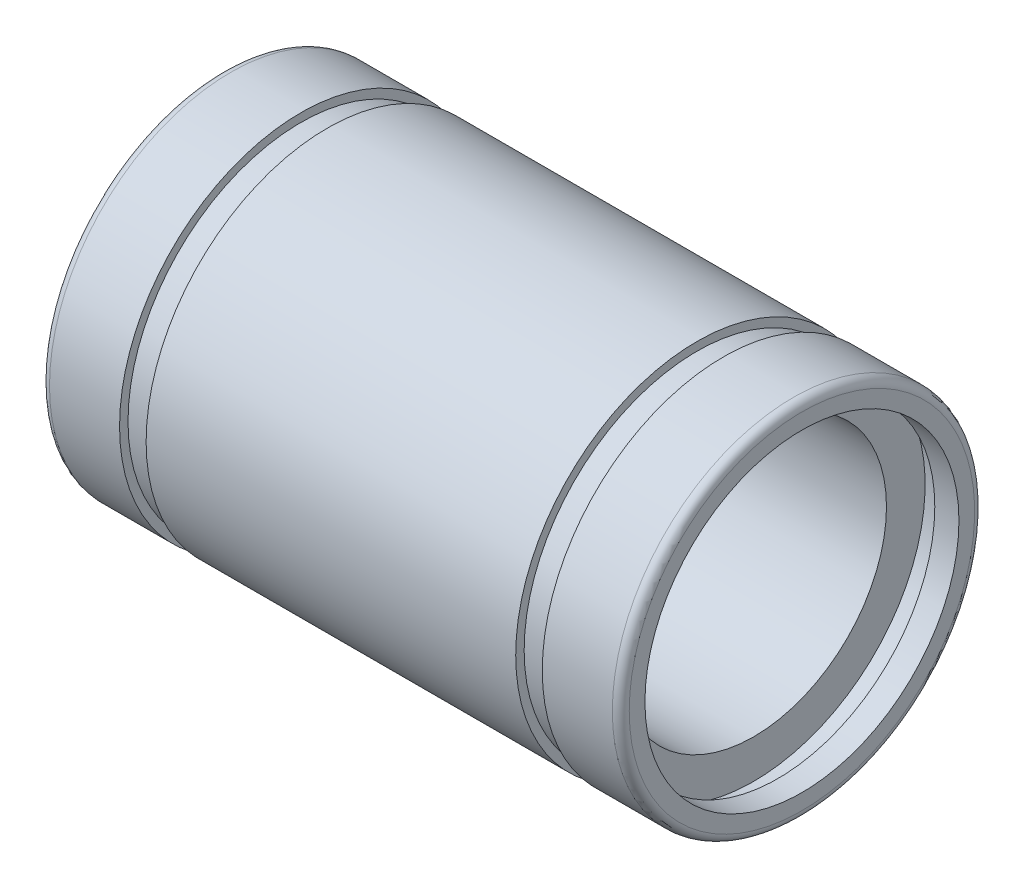
from build123d import *


with BuildPart() as part:
    # Croquis1 → Revolución1 (revolve)
    with BuildSketch(Plane.XY, mode=Mode.PRIVATE) as revoluci_n1_sk:
        with BuildLine():
            Line((24, 7.15), (24, 6.5))
            Line((24, 6.5), (23, 6.5))
            Line((23, 6.5), (23, 7.1))
            Line((23, 7.1), (22, 7.1))
            Line((22, 7.1), (22, 5.5))
            Line((22, 5.5), (2, 5.5))
            Line((2, 5.5), (2, 6.8))
            Line((2, 6.8), (1, 6.8))
            Line((1, 6.8), (1, 6.5))
            Line((1, 6.5), (0, 6.5))
            Line((0, 6.5), (0, 7.15))
            ThreePointArc((0, 7.15), (0.102512627, 7.397487373), (0.35, 7.5))
            Line((0.35, 7.5), (3.25, 7.5))
            Line((3.25, 7.5), (3.25, 7.15))
            Line((3.25, 7.15), (4.35, 7.15))
            Line((4.35, 7.15), (4.35, 7.5))
            Line((4.35, 7.5), (19.65, 7.5))
            Line((19.65, 7.5), (19.65, 7.15))
            Line((19.65, 7.15), (20.75, 7.15))
            Line((20.75, 7.15), (20.75, 7.5))
            Line((20.75, 7.5), (23.65, 7.5))
            ThreePointArc((23.65, 7.5), (23.897487373, 7.397487373), (24, 7.15))
        make_face()
    revolve(revoluci_n1_sk.sketch.rotate(Axis((0, 0, 0), (1, 0, 0)), 90), axis=Axis((0, 0, 0), (1, 0, 0)))


solid = part.part
